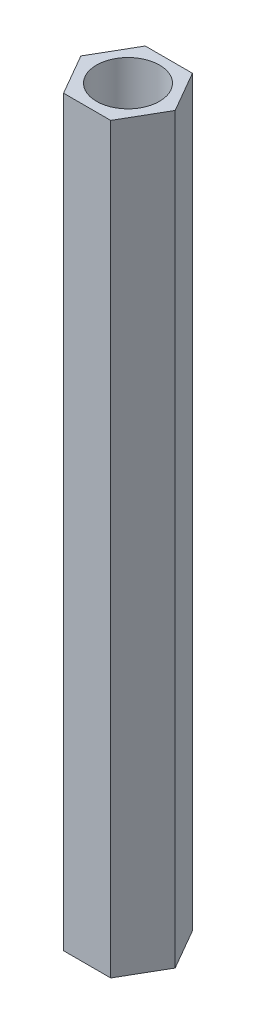
from build123d import *

# Parameters (mm, degrees)
BOSS_EXTRUDE1_DEPTH = 30
SKETCH2_R           = 1.271613046
CUT_EXTRUDE1_DEPTH  = 30


with BuildPart() as part:
    # Sketch1 → Boss-Extrude1 (new body)
    with BuildSketch(Plane(origin=(0, 0, 0), x_dir=(1, 0, 0), z_dir=(0, 1, 0))):
        Polygon((1.905255888, 0), (0.952627944, 1.65), (-0.952627944, 1.65), (-1.905255888, 0), (-0.952627944, -1.65), (0.952627944, -1.65), align=None)
    extrude(amount=BOSS_EXTRUDE1_DEPTH)

    # Sketch2 → Cut-Extrude1 (cut)
    with BuildSketch(Plane(origin=(0, 30, 0), x_dir=(1, 0, 0), z_dir=(0, 1, 0))):
        with Locations(Location((0, 0, 0), (0, 0, 270))):
            Circle(SKETCH2_R)
    extrude(amount=-CUT_EXTRUDE1_DEPTH, mode=Mode.SUBTRACT)


solid = part.part
